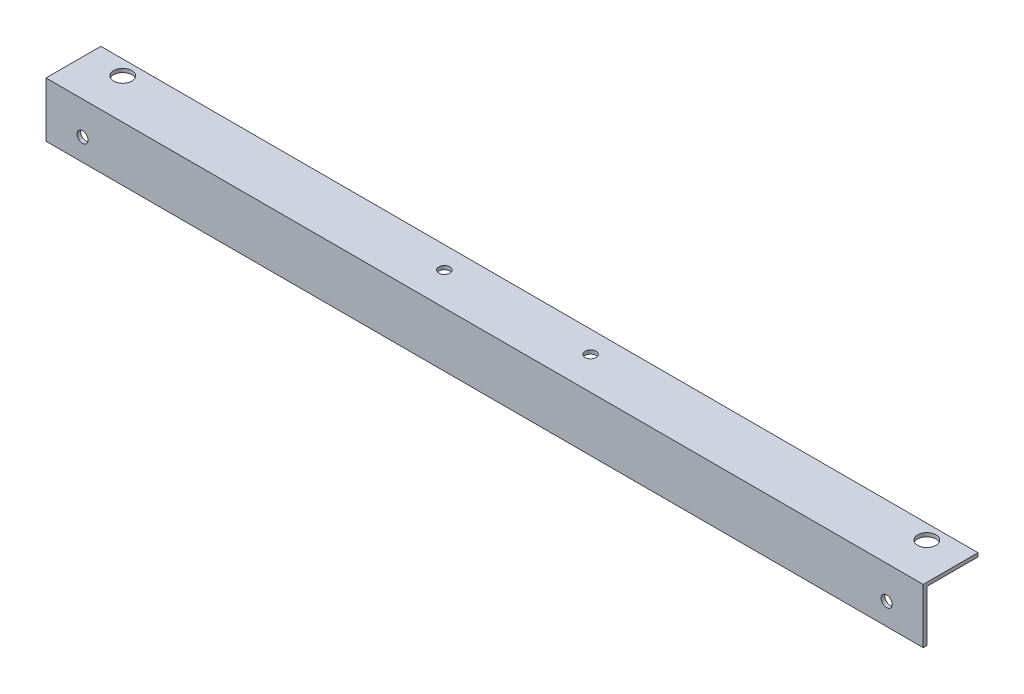
from build123d import *

# Parameters (mm, degrees)
EXTRU_MINCE1_DEPTH      = 120
ESQUISSE2_R             = 1.5
ENL_V_MAT_EXTRU_1_DEPTH = 3
ESQUISSE3_R             = 2.5
ESQUISSE3_R_2           = 1.5
ENL_V_MAT_EXTRU_2_DEPTH = 3


with BuildPart() as part:
    # Esquisse1 → Extru.-Mince1 (new, symmetric)
    with BuildSketch(Plane(origin=(0, 0, 0), x_dir=(0, 0, -1), z_dir=(1, 0, 0))):
        Polygon((0, -15), (0, 0), (15, 0), (15, -1), (1, -1), (1, -15), align=None)
    extrude(amount=EXTRU_MINCE1_DEPTH, both=True)

    # Esquisse2 → Enlèv. mat.-Extru.1 (cut)
    with BuildSketch(Plane.XY):
        with Locations((-110, -9)):
            Circle(ESQUISSE2_R)
        with Locations((110, -9)):
            Circle(ESQUISSE2_R)
    extrude(amount=-ENL_V_MAT_EXTRU_1_DEPTH, mode=Mode.SUBTRACT)

    # Esquisse3 → Enlèv. mat.-Extru.2 (cut)
    with BuildSketch(Plane(origin=(0, 0, 0), x_dir=(1, 0, 0), z_dir=(0, 1, 0))):
        with Locations(Location((-110, 11, 0), (0, 0, 270))):
            Circle(ESQUISSE3_R)
        with Locations(Location((-20, 9, 0), (0, 0, 270))):
            Circle(ESQUISSE3_R_2)
        with Locations(Location((110, 11, 0), (0, 0, 270))):
            Circle(ESQUISSE3_R)
        with Locations(Location((20, 9, 0), (0, 0, 270))):
            Circle(ESQUISSE3_R_2)
    extrude(amount=-ENL_V_MAT_EXTRU_2_DEPTH, mode=Mode.SUBTRACT)


solid = part.part
